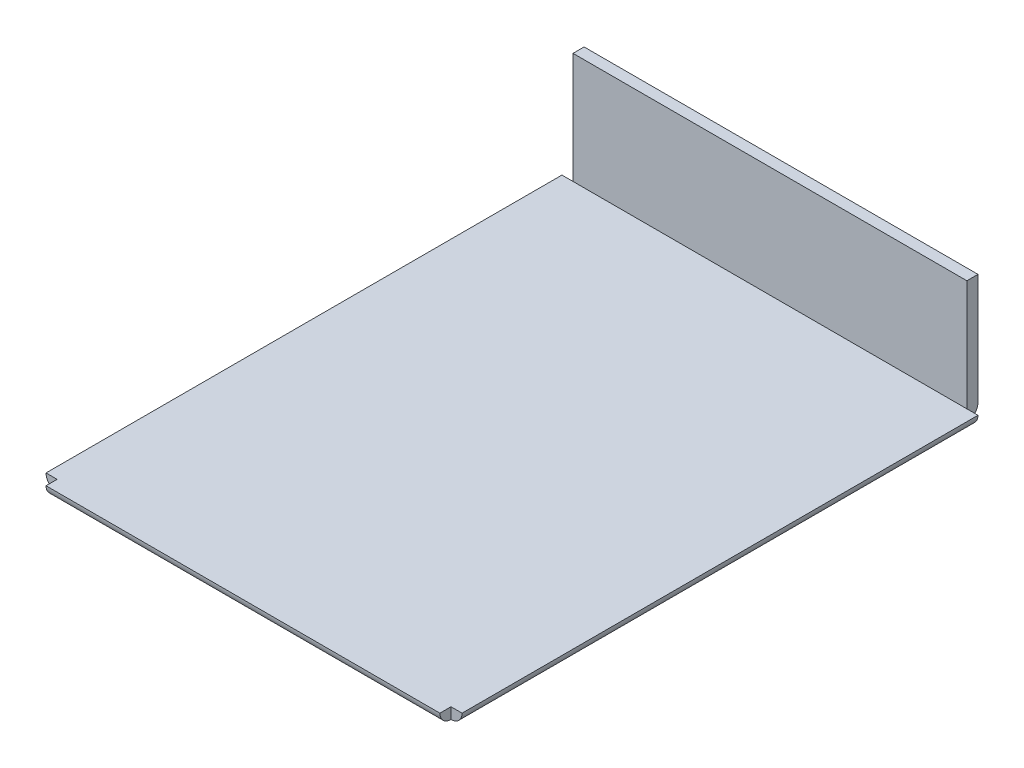
from build123d import *

# Parameters (mm, degrees)
BOTTOM_SIDE_W       = 71
BOTTOM_SIDE_H       = 93
BOTTOM_EXTR_DEPTH   = 2
X_CORNER_W          = 93
X_CORNER_H          = 2
X_CORNER_REV_ANGLE  = 90
Z_CORNER_W          = 71
Z_CORNER_H          = 2
Z_CORNER_REV_ANGLE  = 90
X0_CORNER_W         = 93
X0_CORNER_H         = 2
X0_CORNER_REV_ANGLE = 90
Z0_CORNER_W         = 71
Z0_CORNER_H         = 2
Z0_CORNER_REV_ANGLE = 90
Z0_SIDE_W           = 71
Z0_SIDE_H           = 2
Z0_EXTR_DEPTH       = 20


with BuildPart() as part:
    # bottom side → bottom extr (new body)
    with BuildSketch(Plane(origin=(0, 0, 0), x_dir=(1, 0, 0), z_dir=(0, 1, 0))):
        with Locations((35.5, 46.5)):
            Rectangle(BOTTOM_SIDE_W, BOTTOM_SIDE_H)
    extrude(amount=BOTTOM_EXTR_DEPTH)

    # X+ corner → X+ corner rev (revolve)
    with BuildSketch(Plane(origin=(71, 0, 0), x_dir=(0, 0, -1), z_dir=(1, 0, 0))):
        with Locations((46.5, 1)):
            Rectangle(X_CORNER_W, X_CORNER_H)
    revolve(axis=Axis((71, 2, 0), (0, 0, 1)), revolution_arc=X_CORNER_REV_ANGLE)

    # Z+ corner → Z+ corner rev (revolve)
    with BuildSketch(Plane.XY):
        with Locations((35.5, 1)):
            Rectangle(Z_CORNER_W, Z_CORNER_H)
    revolve(axis=Axis((0, 2, 0), (-1, 0, 0)), revolution_arc=Z_CORNER_REV_ANGLE)

    # X0 corner → X0 corner rev (revolve)
    with BuildSketch(Plane.ZY):
        with Locations((-46.5, 1)):
            Rectangle(X0_CORNER_W, X0_CORNER_H)
    revolve(axis=Axis((0, 2, -93), (0, 0, -1)), revolution_arc=X0_CORNER_REV_ANGLE)

    # Z0 corner → Z0 corner rev (revolve)
    with BuildSketch(Plane(origin=(0, 0, -93), x_dir=(-1, 0, 0), z_dir=(0, 0, -1))):
        with Locations((-35.5, 1)):
            Rectangle(Z0_CORNER_W, Z0_CORNER_H)
    revolve(axis=Axis((71, 2, -93), (1, 0, 0)), revolution_arc=Z0_CORNER_REV_ANGLE)

    # Z0 side → Z0 extr (add)
    with BuildSketch(Plane(origin=(0, 2, 0), x_dir=(1, 0, 0), z_dir=(0, 1, 0))):
        with Locations((35.5, 94)):
            Rectangle(Z0_SIDE_W, Z0_SIDE_H)
    extrude(amount=Z0_EXTR_DEPTH)


solid = part.part
